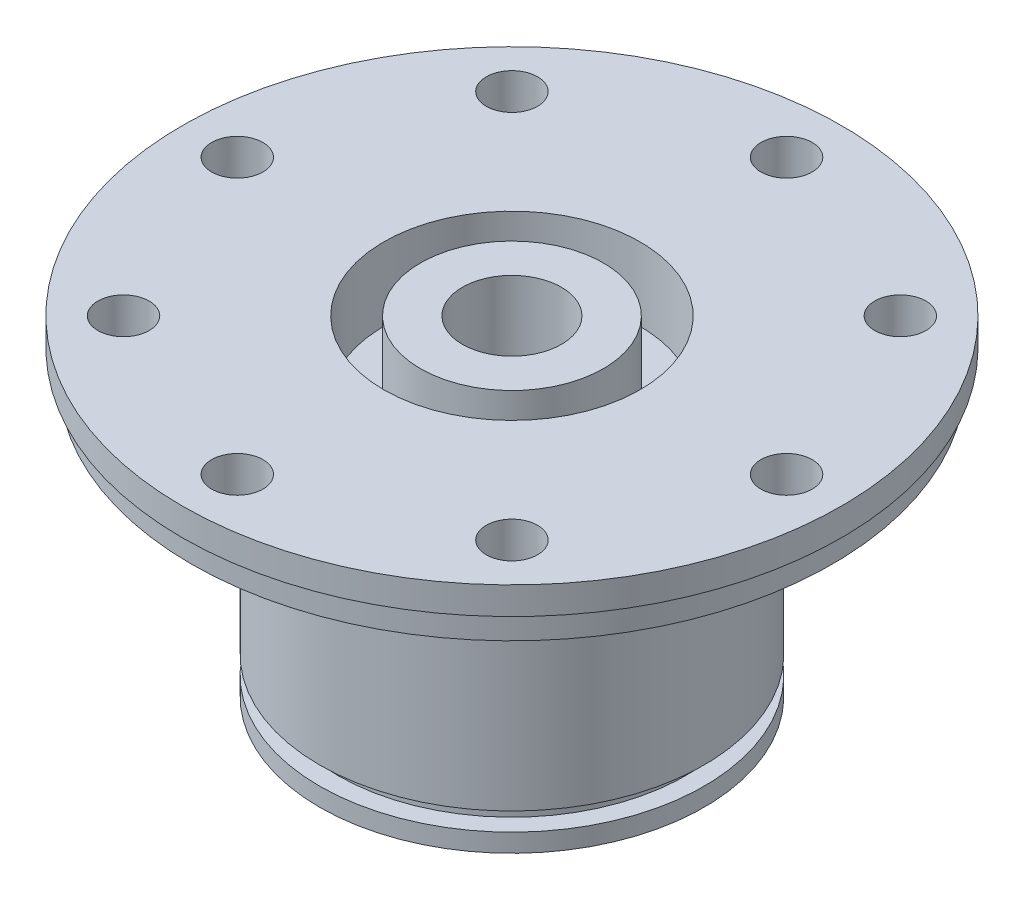
from build123d import *

# Parameters (mm, degrees)
SKETCH1_R           = 18
BOSS_EXTRUDE1_DEPTH = 1.5
SKETCH2_R           = 17.5
BOSS_EXTRUDE2_DEPTH = 1.5
SKETCH3_R           = 12
BOSS_EXTRUDE3_DEPTH = 1
SKETCH4_R           = 10.5
BOSS_EXTRUDE4_DEPTH = 12
SKETCH5_R           = 9.5
BOSS_EXTRUDE5_DEPTH = 1
SKETCH6_R           = 10.5
BOSS_EXTRUDE6_DEPTH = 1
SKETCH8_R           = 2.705
CUT_EXTRUDE1_DEPTH  = 32.176914536
SKETCH9_R           = 7
SKETCH9_R_2         = 5
CUT_EXTRUDE3_DEPTH  = 4
SKETCH10_R          = 1.4
CUT_EXTRUDE4_DEPTH  = 5
CIRPATTERN1_COUNT   = 8


with BuildPart() as part:
    # Sketch1 → Boss-Extrude1 (new body)
    with BuildSketch(Plane(origin=(0, 0, 0), x_dir=(1, 0, 0), z_dir=(0, 1, 0))):
        with Locations(Location((0, 0, 0), (0, 0, 270))):
            Circle(SKETCH1_R)
    extrude(amount=BOSS_EXTRUDE1_DEPTH)

    # Sketch2 → Boss-Extrude2 (add)
    with BuildSketch(Plane.XZ):
        with Locations(Location((0, 0, 0), (0, 0, 270))):
            Circle(SKETCH2_R)
    extrude(amount=BOSS_EXTRUDE2_DEPTH)

    # Sketch3 → Boss-Extrude3 (add)
    with BuildSketch(Plane.XZ.offset(1.5)):
        with Locations(Location((0, 0, 0), (0, 0, 270))):
            Circle(SKETCH3_R)
    extrude(amount=BOSS_EXTRUDE3_DEPTH)

    # Sketch4 → Boss-Extrude4 (add)
    with BuildSketch(Plane.XZ.offset(2.5)):
        with Locations(Location((0, 0, 0), (0, 0, 270))):
            Circle(SKETCH4_R)
    extrude(amount=BOSS_EXTRUDE4_DEPTH)

    # Sketch5 → Boss-Extrude5 (add)
    with BuildSketch(Plane.XZ.offset(14.5)):
        with Locations(Location((0, 0, 0), (0, 0, 270))):
            Circle(SKETCH5_R)
    extrude(amount=BOSS_EXTRUDE5_DEPTH)

    # Sketch6 → Boss-Extrude6 (add)
    with BuildSketch(Plane.XZ.offset(15.5)):
        with Locations(Location((0, 0, 0), (0, 0, 270))):
            Circle(SKETCH6_R)
    extrude(amount=BOSS_EXTRUDE6_DEPTH)

    # Sketch7 → Cut-Revolve1 (revolve, cut)
    with BuildSketch(Plane.XY):
        with BuildLine():
            Line((-8.5, -16.5), (0, -16.5))
            Line((0, -16.5), (0, -8))
            ThreePointArc((0, -8), (-6.01040764, -10.48959236), (-8.5, -16.5))
        make_face()
    revolve(axis=Axis((0, -16.5, 0), (0, 1, 0)), mode=Mode.SUBTRACT)

    # Sketch8 → Cut-Extrude1 (cut, through all)
    with BuildSketch(Plane(origin=(0, 1.5, 0), x_dir=(1, 0, 0), z_dir=(0, 1, 0))):
        with Locations(Location((0, 0, 0), (0, 0, 270))):
            Circle(SKETCH8_R)
    extrude(amount=-CUT_EXTRUDE1_DEPTH, mode=Mode.SUBTRACT)

    # Sketch9 → Cut-Extrude3 (cut)
    with BuildSketch(Plane(origin=(0, 1.5, 0), x_dir=(1, 0, 0), z_dir=(0, 1, 0))):
        with Locations(Location((0, 0, 0), (0, 0, 270))):
            Circle(SKETCH9_R)
        with Locations(Location((0, 0, 0), (0, 0, 270))):
            Circle(SKETCH9_R_2, mode=Mode.SUBTRACT)
    extrude(amount=-CUT_EXTRUDE3_DEPTH, mode=Mode.SUBTRACT)

    # Sketch10 → Cut-Extrude4 (cut)
    with BuildSketch(Plane(origin=(0, 1.5, 0), x_dir=(1, 0, 0), z_dir=(0, 1, 0))):
        with Locations(Location((0, 15, 0), (0, 0, 270))):
            Circle(SKETCH10_R)
    cut_extrude4 = extrude(amount=-CUT_EXTRUDE4_DEPTH, mode=Mode.SUBTRACT)

    # CirPattern1: Cut-Extrude4 ×8 about axis
    cirpattern1_axis = Axis((0, 0, 0), (0, 1, 0))
    for i in range(1, CIRPATTERN1_COUNT):
        add(cut_extrude4.rotate(cirpattern1_axis, i * 360 / CIRPATTERN1_COUNT), mode=Mode.SUBTRACT)


solid = part.part
